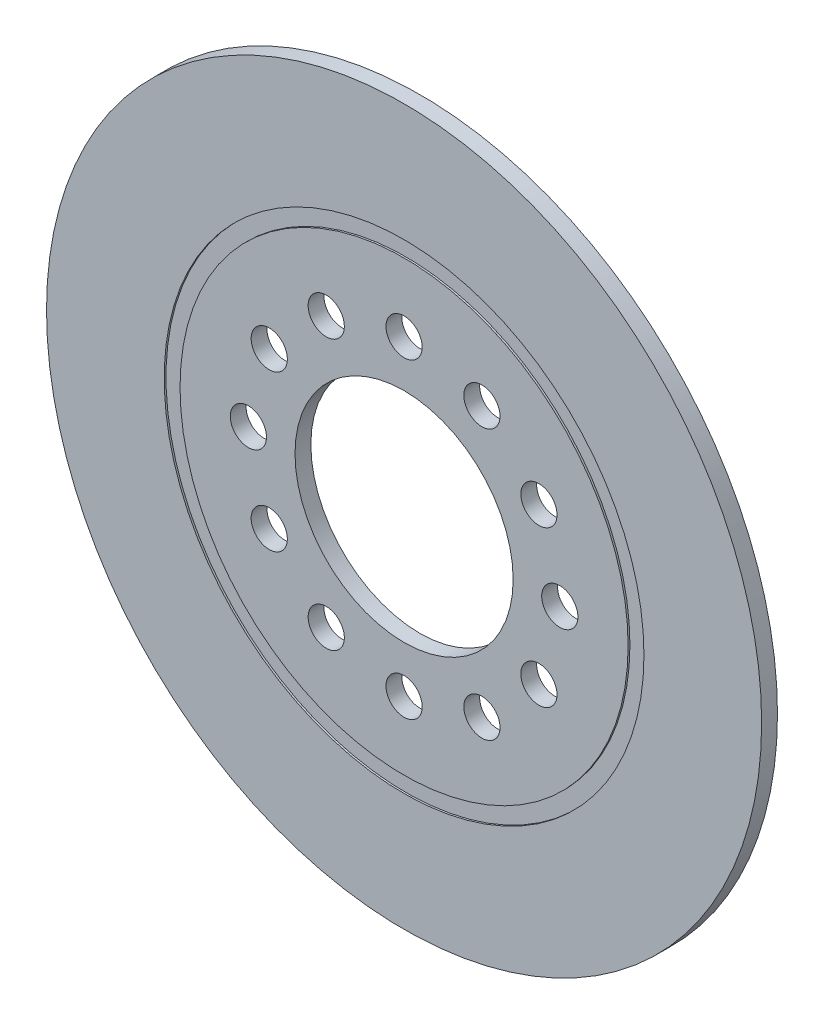
from build123d import *

# Parameters (mm, degrees)
SKETCH1_R           = 79
BOSS_EXTRUDE1_DEPTH = 3.5
SKETCH2_R           = 4
SKETCH2_R_2         = 24.1
CUT_EXTRUDE1_DEPTH  = 112.777681135
SKETCH3_R           = 53
SKETCH3_R_2         = 49.5
CUT_EXTRUDE2_DEPTH  = 0.4


with BuildPart() as part:
    # Sketch1 → Boss-Extrude1 (new body)
    with BuildSketch(Plane.XY):
        Circle(SKETCH1_R)
    extrude(amount=BOSS_EXTRUDE1_DEPTH)

    # Sketch2 → Cut-Extrude1 (cut, through all)
    with BuildSketch(Plane.XY):
        with Locations((34.4, 0)):
            Circle(SKETCH2_R)
        with Locations((29.79127389, -17.2)):
            Circle(SKETCH2_R)
        with Locations((17.2, -29.79127389)):
            Circle(SKETCH2_R)
        with Locations((0, -34.4)):
            Circle(SKETCH2_R)
        with Locations((-17.2, -29.79127389)):
            Circle(SKETCH2_R)
        with Locations((-29.79127389, -17.2)):
            Circle(SKETCH2_R)
        with Locations((-34.4, 0)):
            Circle(SKETCH2_R)
        with Locations((-29.79127389, 17.2)):
            Circle(SKETCH2_R)
        with Locations((-17.2, 29.79127389)):
            Circle(SKETCH2_R)
        with Locations((0, 34.4)):
            Circle(SKETCH2_R)
        with Locations((17.2, 29.79127389)):
            Circle(SKETCH2_R)
        with Locations((29.79127389, 17.2)):
            Circle(SKETCH2_R)
        Circle(SKETCH2_R_2)
    extrude(amount=CUT_EXTRUDE1_DEPTH, mode=Mode.SUBTRACT)

    # Sketch3 → Cut-Extrude2 (cut)
    with BuildSketch(Plane.XY.offset(3.5)):
        Circle(SKETCH3_R)
        Circle(SKETCH3_R_2, mode=Mode.SUBTRACT)
    extrude(amount=-CUT_EXTRUDE2_DEPTH, mode=Mode.SUBTRACT)


solid = part.part
